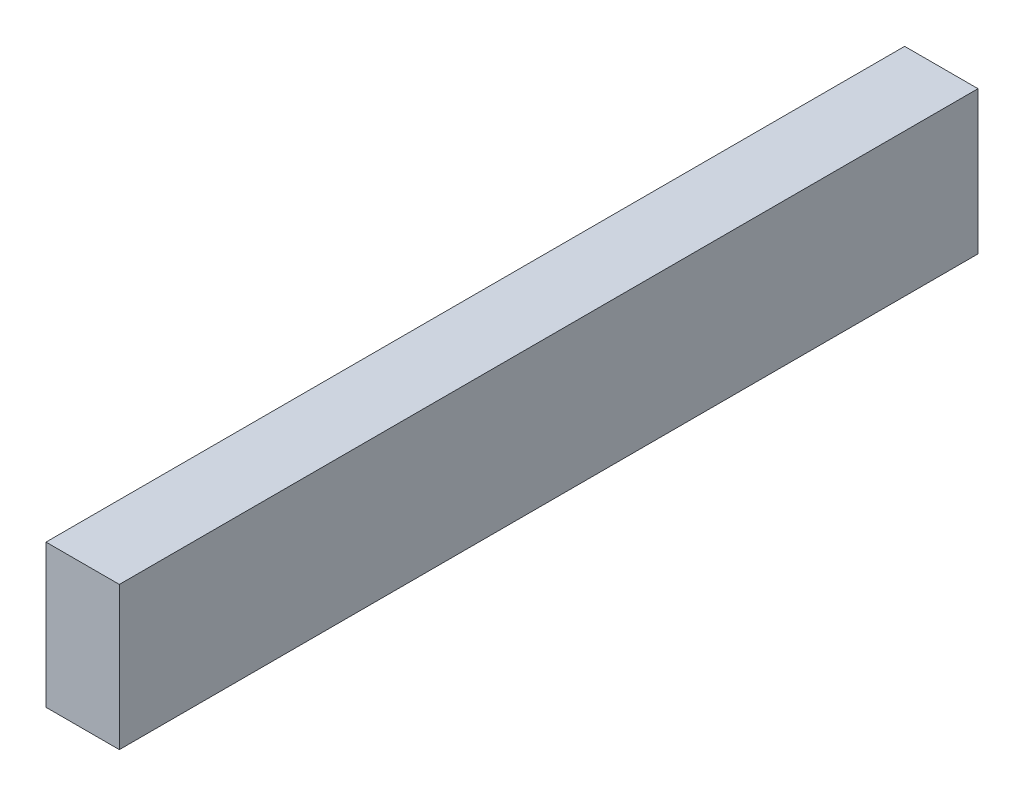
from build123d import *

# Parameters (mm, degrees)
SKETCH_1_W      = 2.05
SKETCH_1_H      = 24
EXTRUDE_2_DEPTH = 4


with BuildPart() as part:
    # ｽｹｯﾁ1 → ﾎﾞｽ - 押し出し2 (new body)
    with BuildSketch(Plane(origin=(0, 0, 0), x_dir=(1, 0, 0), z_dir=(0, 1, 0))):
        with Locations((1.025, 12)):
            Rectangle(SKETCH_1_W, SKETCH_1_H)
    extrude(amount=EXTRUDE_2_DEPTH)


solid = part.part
